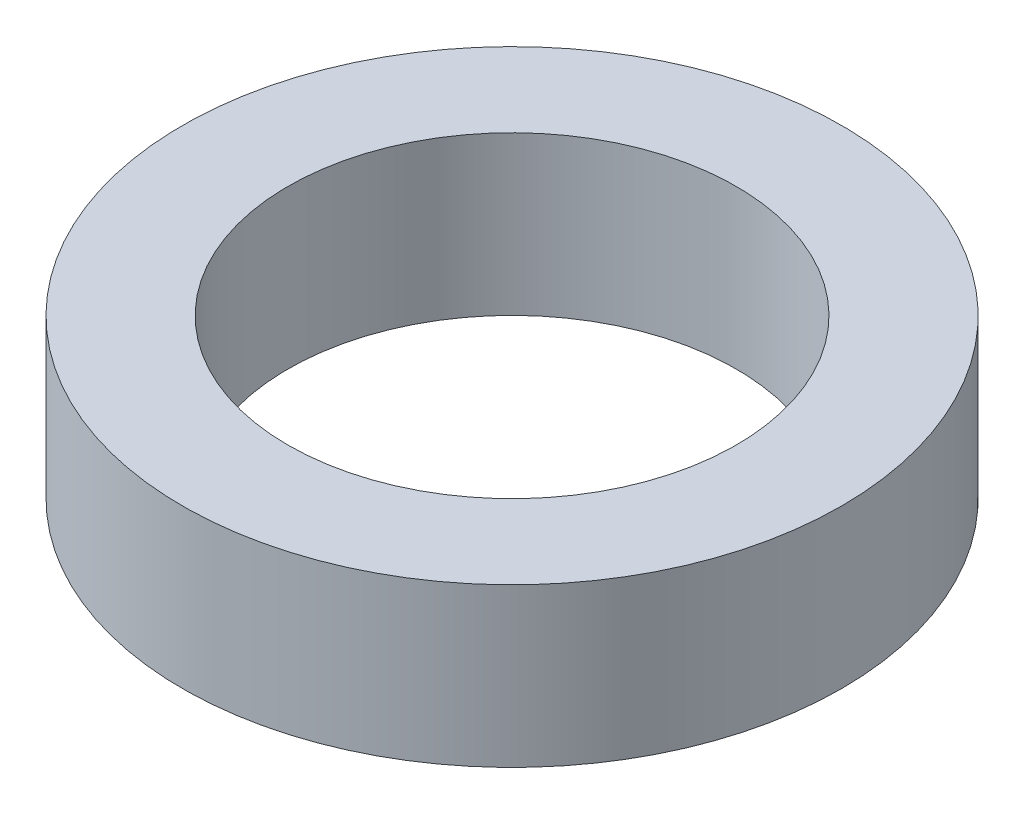
from build123d import *

# Parameters (mm, degrees)
SKETCH1_R           = 6.25
SKETCH1_R_2         = 4.25
EXTRUDE_THIN1_DEPTH = 3


with BuildPart() as part:
    # Sketch1 → Extrude-Thin1 (new body)
    with BuildSketch(Plane(origin=(0, 0, 0), x_dir=(1, 0, 0), z_dir=(0, 1, 0))):
        Circle(SKETCH1_R)
        Circle(SKETCH1_R_2, mode=Mode.SUBTRACT)
    extrude(amount=EXTRUDE_THIN1_DEPTH)


solid = part.part
